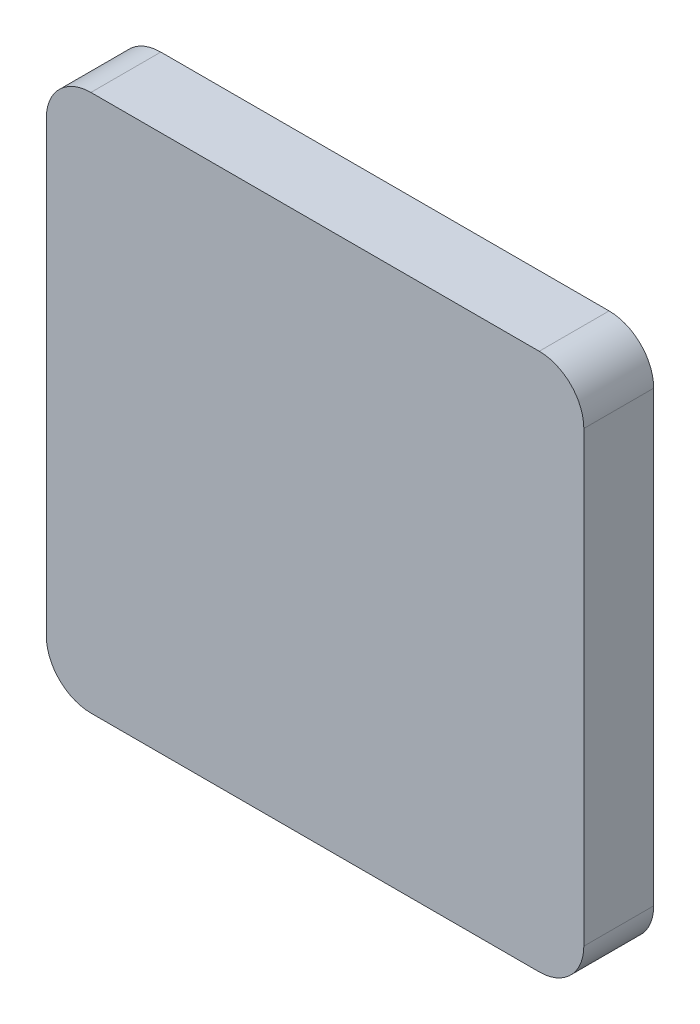
from build123d import *

# Parameters (mm, degrees)
BOSS_EXTRUDE1_DEPTH = 3.302


with BuildPart() as part:
    # Sketch1 → Boss-Extrude1 (new body)
    with BuildSketch(Plane(origin=(0, 0, 0), x_dir=(-1, 0, 0), z_dir=(0, 0, 1))):
        with BuildLine():
            Line((10.5918, 12.7), (-10.5918, 12.7))
            ThreePointArc((-10.5918, 12.7), (-12.082522516, 12.082522516), (-12.7, 10.5918))
            Line((-12.7, 10.5918), (-12.7, -10.5918))
            ThreePointArc((-12.7, -10.5918), (-12.082522516, -12.082522516), (-10.5918, -12.7))
            Line((-10.5918, -12.7), (10.5918, -12.7))
            ThreePointArc((10.5918, -12.7), (12.082522516, -12.082522516), (12.7, -10.5918))
            Line((12.7, -10.5918), (12.7, 10.5918))
            ThreePointArc((12.7, 10.5918), (12.082522516, 12.082522516), (10.5918, 12.7))
        make_face()
    extrude(amount=BOSS_EXTRUDE1_DEPTH)


solid = part.part
